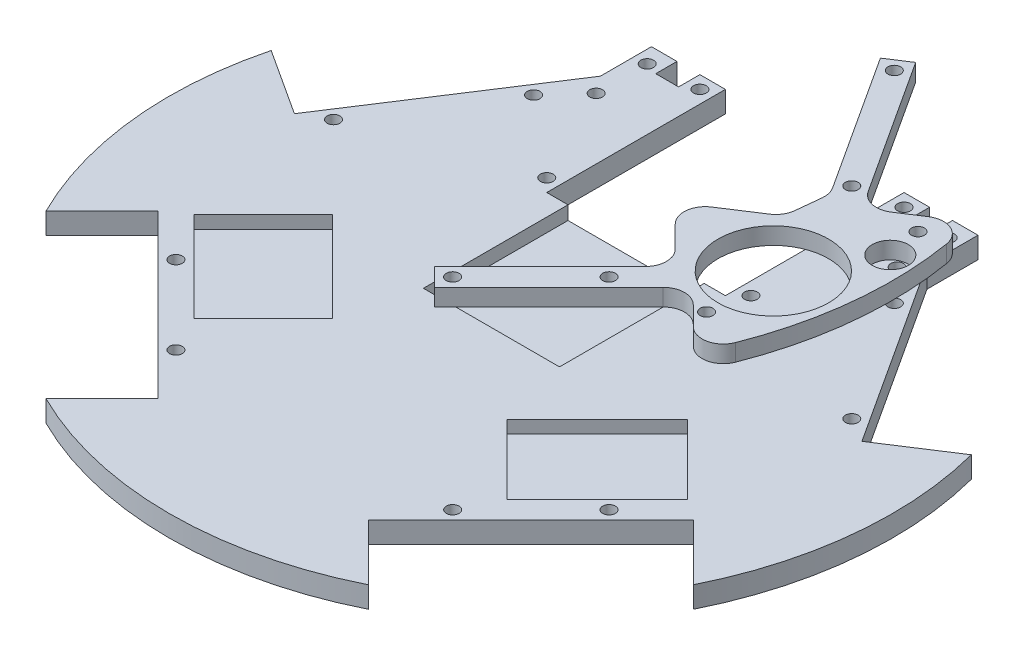
from build123d import *

# Parameters (mm, degrees)
EXTRUDE1_DEPTH  = 5
SKETCH3_W       = 42
SKETCH3_H       = 47
EXTRUDE2_DEPTH  = 5
SKETCH4_W       = 32
SKETCH4_H       = 40
EXTRUDE3_DEPTH  = 3.2
EXTRUDE4_DEPTH  = 3
SKETCH6_R       = 1.5
EXTRUDE5_DEPTH  = 5
SKETCH7_R       = 1.5
EXTRUDE6_DEPTH  = 5
SKETCH8_W       = 5.381599337
SKETCH8_H       = 7
EXTRUDE7_DEPTH  = 5
SKETCH9_R       = 1.5
EXTRUDE8_DEPTH  = 5
EXTRUDE9_START  = 4
SKETCH10_R      = 1.5
EXTRUDE9_DEPTH  = 4
SKETCH14_R      = 4.25
EXTRUDE12_DEPTH = 4
SKETCH18_R      = 1.5
EXTRUDE16_DEPTH = 4
EXTRUDE18_DEPTH = 4
FILLET5_R       = 5
SKETCH23_R      = 1.5
EXTRUDE19_DEPTH = 4
SKETCH17_R      = 13
EXTRUDE20_DEPTH = 4


with BuildPart() as part:
    # Sketch2 → Extrude1 (new body)
    with BuildSketch(Plane(origin=(0, 0, 0), x_dir=(1, 0, 0), z_dir=(0, 1, 0))):
        with BuildLine():
            Line((82.300228734, 21.252584555), (66.702829158, 11.123514836))
            Line((66.702829158, 11.123514836), (38.381599337, 54.73438437))
            Line((38.381599337, 54.73438437), (38.381599337, 66.73438437))
            Line((38.381599337, 66.73438437), (-38.381599337, 66.73438437))
            Line((-38.381599337, 66.73438437), (-38.381599337, 54.73438437))
            Line((-38.381599337, 54.73438437), (-66.702829158, 11.123514836))
            Line((-66.702829158, 11.123514836), (-82.300228734, 21.252584555))
            ThreePointArc((-82.300228734, 21.252584555), (-84.534361106, -8.884919378), (-76.083110487, -37.899344303))
            Line((-76.083110487, -37.899344303), (-62.932503526, -24.748737342))
            Line((-62.932503526, -24.748737342), (-24.748737342, -62.932503526))
            Line((-24.748737342, -62.932503526), (-37.899344303, -76.083110487))
            ThreePointArc((-37.899344303, -76.083110487), (0, -85), (37.899344303, -76.083110487))
            Line((37.899344303, -76.083110487), (24.748737342, -62.932503526))
            Line((24.748737342, -62.932503526), (62.932503526, -24.748737342))
            Line((62.932503526, -24.748737342), (76.083110487, -37.899344303))
            ThreePointArc((76.083110487, -37.899344303), (84.534361106, -8.884919378), (82.300228734, 21.252584555))
        make_face()
    extrude(amount=-EXTRUDE1_DEPTH)

    # Sketch3 → Extrude2 (cut)
    with BuildSketch(Plane(origin=(0, 0, 0), x_dir=(1, 0, 0), z_dir=(0, 1, 0))):
        with Locations((0, 48.23438437)):
            Rectangle(SKETCH3_W, SKETCH3_H)
    extrude(amount=-EXTRUDE2_DEPTH, mode=Mode.SUBTRACT)

    # Sketch4 → Extrude3 (cut)
    with BuildSketch(Plane(origin=(0, 0, 0), x_dir=(-1, 0, 0), z_dir=(0, 1, 0))):
        with Locations((0, -10.73438437)):
            Rectangle(SKETCH4_W, SKETCH4_H)
    extrude(amount=-EXTRUDE3_DEPTH, mode=Mode.SUBTRACT)

    # Sketch5 → Extrude4 (cut)
    with BuildSketch(Plane(origin=(0, 0, 0), x_dir=(1, 0, 0), z_dir=(0, 1, 0))):
        Polygon((36.769552622, -42.426406871), (57.982756057, -21.213203436), (41.71930009, -4.949747468), (20.506096654, -26.162950904), align=None)
    extrude4 = extrude(amount=-EXTRUDE4_DEPTH, mode=Mode.SUBTRACT)

    # Mirror1: Extrude4 across plane
    add(extrude4.mirror(Plane(origin=(0, 0, 0), x_dir=(0, 0, 1), z_dir=(1, 0, 0))), mode=Mode.SUBTRACT)

    # Sketch6 → Extrude5 (cut)
    with BuildSketch(Plane(origin=(0, 0, 0), x_dir=(1, 0, 0), z_dir=(0, 1, 0))):
        with Locations(Location((42.401256054, 43.036420449, 0), (0, 0, 270))):
            Circle(SKETCH6_R)
        with Locations(Location((60.918983244, 14.521621139, 0), (0, 0, 270))):
            Circle(SKETCH6_R)
        with Locations(Location((50.911688245, -32.526911935, 0), (0, 0, 270))):
            Circle(SKETCH6_R)
        with Locations(Location((32.526911935, -50.911688245, 0), (0, 0, 270))):
            Circle(SKETCH6_R)
    extrude5 = extrude(amount=-EXTRUDE5_DEPTH, mode=Mode.SUBTRACT)

    # Mirror2: Extrude5 across plane
    add(extrude5.mirror(Plane(origin=(0, 0, 0), x_dir=(0, 0, 1), z_dir=(1, 0, 0))), mode=Mode.SUBTRACT)

    # Sketch7 → Extrude6 (cut)
    with BuildSketch(Plane(origin=(0, 0, 0), x_dir=(-1, 0, 0), z_dir=(0, 1, 0))):
        with Locations(Location((-24, -63.73438437, 0), (0, 0, 90))):
            Circle(SKETCH7_R)
        with Locations(Location((-24, -27.73438437, 0), (0, 0, 90))):
            Circle(SKETCH7_R)
    extrude6 = extrude(amount=-EXTRUDE6_DEPTH, mode=Mode.SUBTRACT)

    # Mirror3: Extrude6 across plane
    add(extrude6.mirror(Plane(origin=(0, 0, 0), x_dir=(0, 0, 1), z_dir=(1, 0, 0))), mode=Mode.SUBTRACT)

    # Sketch8 → Extrude7 (cut)
    with BuildSketch(Plane(origin=(0, 0, 0), x_dir=(1, 0, 0), z_dir=(0, 1, 0))):
        with Locations((29.690799669, 65.23438437)):
            Rectangle(SKETCH8_W, SKETCH8_H)
    extrude7 = extrude(amount=-EXTRUDE7_DEPTH, mode=Mode.SUBTRACT)

    # Mirror4: Extrude7 across plane
    add(extrude7.mirror(Plane(origin=(0, 0, 0), x_dir=(0, 0, 1), z_dir=(1, 0, 0))), mode=Mode.SUBTRACT)

    # Sketch9 → Extrude8 (cut)
    with BuildSketch(Plane(origin=(0, 0, 0), x_dir=(1, 0, 0), z_dir=(0, 1, 0))):
        with Locations(Location((35.381599337, 62.73438437, 0), (0, 0, 270))):
            Circle(SKETCH9_R)
        with Locations(Location((35.381599337, 50.73438437, 0), (0, 0, 270))):
            Circle(SKETCH9_R)
    extrude8 = extrude(amount=-EXTRUDE8_DEPTH, mode=Mode.SUBTRACT)

    # Mirror5: Extrude8 across plane
    add(extrude8.mirror(Plane(origin=(0, 0, 0), x_dir=(0, 0, 1), z_dir=(1, 0, 0))), mode=Mode.SUBTRACT)


with BuildPart() as body_2:
    # Sketch10 → Extrude9 (new body)
    with BuildSketch(Plane(origin=(0, 43.4, 0), x_dir=(-1, 0, 0), z_dir=(0, 1, 0)).offset(EXTRUDE9_START)):
        with BuildLine():
            Line((-43.283350652, -47.186349258), (-38.251327245, -43.918515048))
            Line((-38.251327245, -43.918515048), (-60.036888645, -10.37169233))
            Line((-60.036888645, -10.37169233), (-56.568542495, 22.627416998))
            Line((-56.568542495, 22.627416998), (-28.284271247, 50.911688245))
            Line((-28.284271247, 50.911688245), (-32.526911935, 55.154328933))
            Line((-32.526911935, 55.154328933), (-62.932503526, 24.748737342))
            Line((-62.932503526, 24.748737342), (-76.083110487, 37.899344303))
            ThreePointArc((-76.083110487, 37.899344303), (-84.534361106, 8.884919378), (-82.300228734, -21.252584555))
            Line((-82.300228734, -21.252584555), (-66.702829158, -11.123514836))
            Line((-66.702829158, -11.123514836), (-43.283350652, -47.186349258))
        make_face()
        with Locations(Location((-42.401256054, -43.036420449, 0), (0, 0, 90))):
            Circle(SKETCH10_R, mode=Mode.SUBTRACT)
        with Locations(Location((-60.918983244, -14.521621139, 0), (0, 0, 90))):
            Circle(SKETCH10_R, mode=Mode.SUBTRACT)
        with Locations(Location((-50.911688245, 32.526911935, 0), (0, 0, 90))):
            Circle(SKETCH10_R, mode=Mode.SUBTRACT)
        with Locations(Location((-32.526911935, 50.911688245, 0), (0, 0, 90))):
            Circle(SKETCH10_R, mode=Mode.SUBTRACT)
    extrude(amount=-EXTRUDE9_DEPTH)

    # Sketch14 → Extrude12 (cut)
    with BuildSketch(Plane(origin=(0, 47.4, 0), x_dir=(1, 0, 0), z_dir=(0, 1, 0))):
        with Locations(Location((79.5, 5, 0), (0, 0, 270))):
            Circle(SKETCH14_R)
    extrude(amount=-EXTRUDE12_DEPTH, mode=Mode.SUBTRACT)

    # Sketch18 → Extrude16 (cut)
    with BuildSketch(Plane(origin=(0, 47.4, 0), x_dir=(1, 0, 0), z_dir=(0, 1, 0))):
        with Locations(Location((78, 13, 0), (0, 0, 270))):
            Circle(SKETCH18_R)
    extrude(amount=-EXTRUDE16_DEPTH, mode=Mode.SUBTRACT)

    # Sketch21 → Extrude18 (add)
    with BuildSketch(Plane(origin=(0, 47.4, 0), x_dir=(1, 0, 0), z_dir=(0, 1, 0))):
        Polygon((56.568542495, -22.627416998), (43.545481419, -9.604355922), (58.991604013, 0.426473376), align=None)
    extrude(amount=-EXTRUDE18_DEPTH)

    # Fillet5
    fillet5_edges = [body_2.edges().sort_by_distance(p)[0] for p in [
        (66.702829158, 45.4, -11.123514836),
        (82.300228734, 45.4, -21.252584555),
        (76.083110487, 45.4, 37.899344303),
        (62.932503526, 45.4, 24.748737342),
        (56.568542495, 45.4, 22.627416998),
        (60.036888645, 45.4, -10.37169233),
        (43.545481419, 45.4, 9.604355922),
        (58.991604013, 45.4, -0.426473376),
    ]]
    fillet(fillet5_edges, radius=FILLET5_R)

    # Sketch23 → Extrude19 (cut)
    with BuildSketch(Plane(origin=(0, 47.4, 0), x_dir=(1, 0, 0), z_dir=(0, 1, 0))):
        with Locations(Location((69.5, -28.2, 0), (0, 0, 270))):
            Circle(SKETCH23_R)
    extrude(amount=-EXTRUDE19_DEPTH, mode=Mode.SUBTRACT)

    # Sketch17 → Extrude20 (cut)
    with BuildSketch(Plane(origin=(0, 47.4, 0), x_dir=(1, 0, 0), z_dir=(0, 1, 0))):
        with Locations(Location((69, -12, 0), (0, 0, 270))):
            Circle(SKETCH17_R)
    extrude(amount=-EXTRUDE20_DEPTH, mode=Mode.SUBTRACT)


solid = Compound([part.part, body_2.part])
